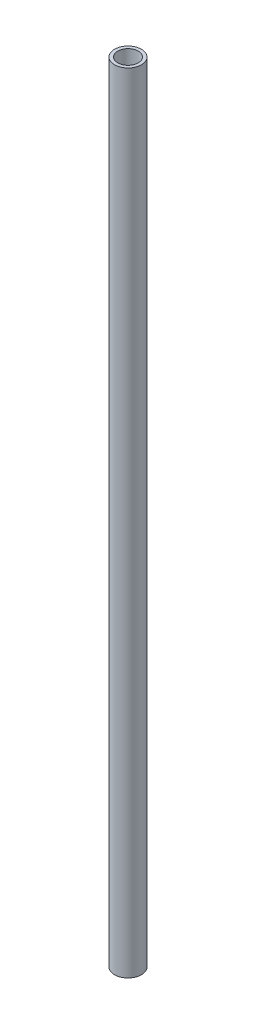
from build123d import *

# Parameters (mm, degrees)
SKETCH1_R           = 21
SKETCH1_R_2         = 16
EXTRUDE_THIN1_DEPTH = 615


with BuildPart() as part:
    # Sketch1 → Extrude-Thin1 (new, symmetric)
    with BuildSketch(Plane(origin=(0, 0, 0), x_dir=(1, 0, 0), z_dir=(0, 1, 0))):
        Circle(SKETCH1_R)
        Circle(SKETCH1_R_2, mode=Mode.SUBTRACT)
    extrude(amount=EXTRUDE_THIN1_DEPTH, both=True)


solid = part.part
